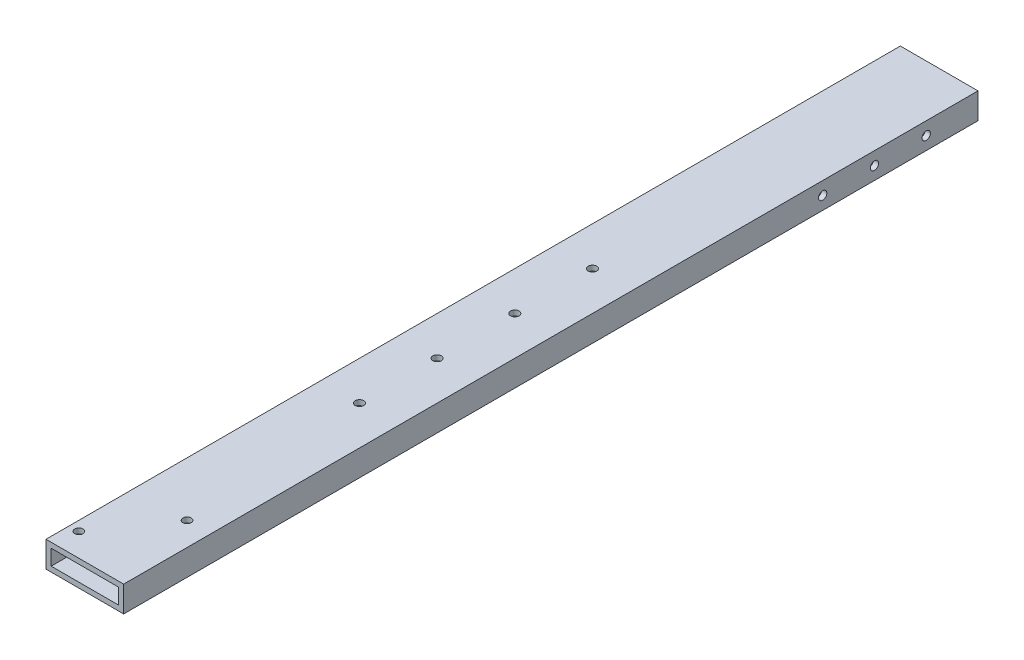
from build123d import *

# Parameters (mm, degrees)
SKETCH_1_W          = 30
SKETCH_1_H          = 10
SKETCH_1_W_2        = 26
SKETCH_1_H_2        = 6
EXTRUDE_1_DEPTH     = 330
SKETCH_2_R          = 1.6
CUT_EXTRUDE_1_DEPTH = 331.492057393
SKETCH_3_R          = 1.6
SKETCH_3_R_2        = 1.65
CUT_EXTRUDE_2_DEPTH = 331.492057393
SKETCH_4_R          = 1.6
CUT_EXTRUDE_3_DEPTH = 332.398551596


with BuildPart() as part:
    # 草图1 → 凸台-拉伸1 (new body)
    with BuildSketch(Plane.XY):
        Rectangle(SKETCH_1_W, SKETCH_1_H)
        Rectangle(SKETCH_1_W_2, SKETCH_1_H_2, mode=Mode.SUBTRACT)
    extrude(amount=EXTRUDE_1_DEPTH)

    # 草图2 → 切除-拉伸1 (cut, through all)
    with BuildSketch(Plane(origin=(0, 5, 0), x_dir=(1, 0, 0), z_dir=(0, 1, 0))):
        with Locations(Location((-11.3, -321, 0), (0, 0, 270))):
            Circle(SKETCH_2_R)
    extrude(amount=-CUT_EXTRUDE_1_DEPTH, mode=Mode.SUBTRACT)

    # 草图3 → 切除-拉伸2 (cut, through all)
    with BuildSketch(Plane(origin=(0, 5, 0), x_dir=(1, 0, 0), z_dir=(0, 1, 0))):
        with Locations(Location((5.907293091, -296.425438671, 0), (0, 0, 270))):
            Circle(SKETCH_3_R)
        with Locations(Location((0, -163.912345182, 0), (0, 0, 270))):
            Circle(SKETCH_3_R_2)
        with Locations(Location((0, -133.912345182, 0), (0, 0, 270))):
            Circle(SKETCH_3_R_2)
        with Locations(Location((0, -223.912345182, 0), (0, 0, 270))):
            Circle(SKETCH_3_R_2)
        with Locations(Location((0, -193.912345182, 0), (0, 0, 270))):
            Circle(SKETCH_3_R_2)
    extrude(amount=-CUT_EXTRUDE_2_DEPTH, mode=Mode.SUBTRACT)

    # 草图4 → 切除-拉伸3 (cut, through all)
    with BuildSketch(Plane.ZY.offset(15)):
        with Locations((20, 0)):
            Circle(SKETCH_4_R)
        with Locations((40, 0)):
            Circle(SKETCH_4_R)
        with Locations((60, 0)):
            Circle(SKETCH_4_R)
    extrude(amount=-CUT_EXTRUDE_3_DEPTH, mode=Mode.SUBTRACT)


solid = part.part
